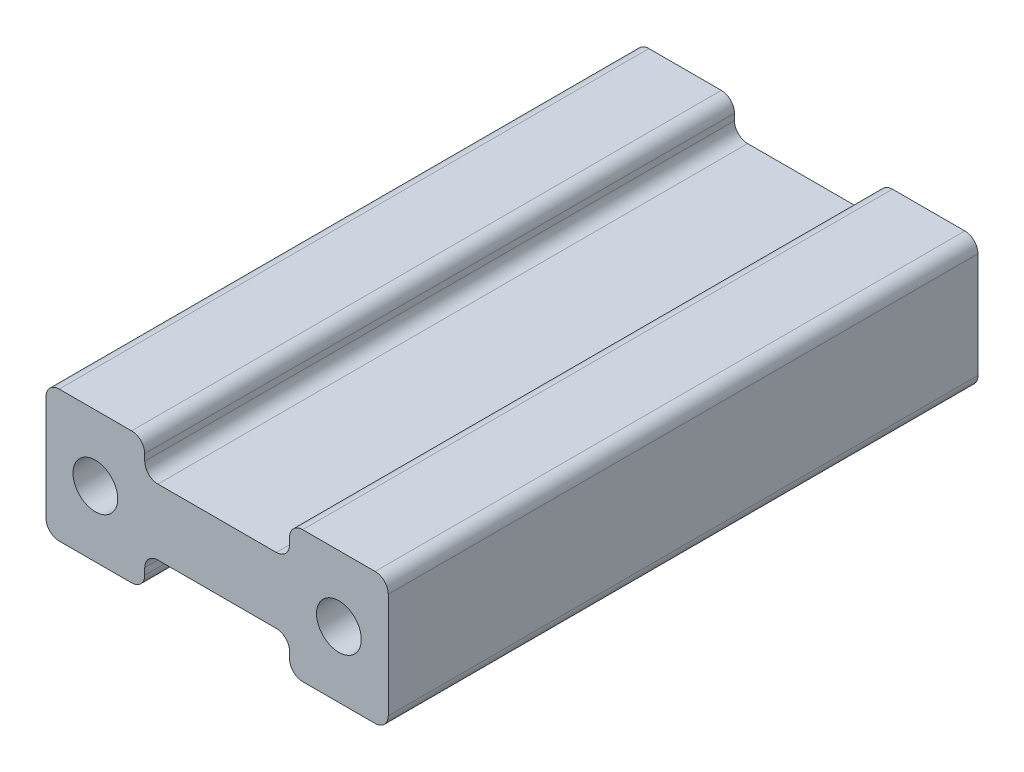
from build123d import *

# Parameters (mm, degrees)
SALIENTE_EXTRUIR1_DEPTH      = 22.4
REDONDEO1_R                  = 1
TALADRO_DE_MARGEN_PARA_M31_D = 3.4


with BuildPart() as part:
    # Croquis1 → Saliente-Extruir1 (new, symmetric)
    with BuildSketch(Plane(origin=(0, 0, 0), x_dir=(0, 1, 0), z_dir=(0, 0, 1))):
        Polygon((-5, 13), (5, 13), (5, 5.5), (2.5, 5.5), (2.5, -5.5), (5, -5.5), (5, -13), (-5, -13), (-5, -5.5), (-2.5, -5.5), (-2.5, 5.5), (-5, 5.5), align=None)
    extrude(amount=SALIENTE_EXTRUIR1_DEPTH, both=True)

    # Redondeo1
    redondeo1_edges = [part.edges().sort_by_distance(p)[0] for p in [
        (-5.5, -5, 0),
        (-13, -5, 0),
        (-13, 5, 0),
        (-5.5, 5, 0),
        (-5.5, 2.5, 0),
        (5.5, 2.5, 0),
        (5.5, 5, 0),
        (13, 5, 0),
        (13, -5, 0),
        (5.5, -5, 0),
        (5.5, -2.5, 0),
        (-5.5, -2.5, 0),
    ]]
    fillet(redondeo1_edges, radius=REDONDEO1_R)

    # Taladro de margen para M31 (through all)
    with Locations(Plane(origin=(0, 0, -22.4), x_dir=(1, 0, 0), z_dir=(0, 0, -1))):
        with Locations((9.25, 0), (-9.25, 0)):
            Hole(TALADRO_DE_MARGEN_PARA_M31_D / 2)


solid = part.part
